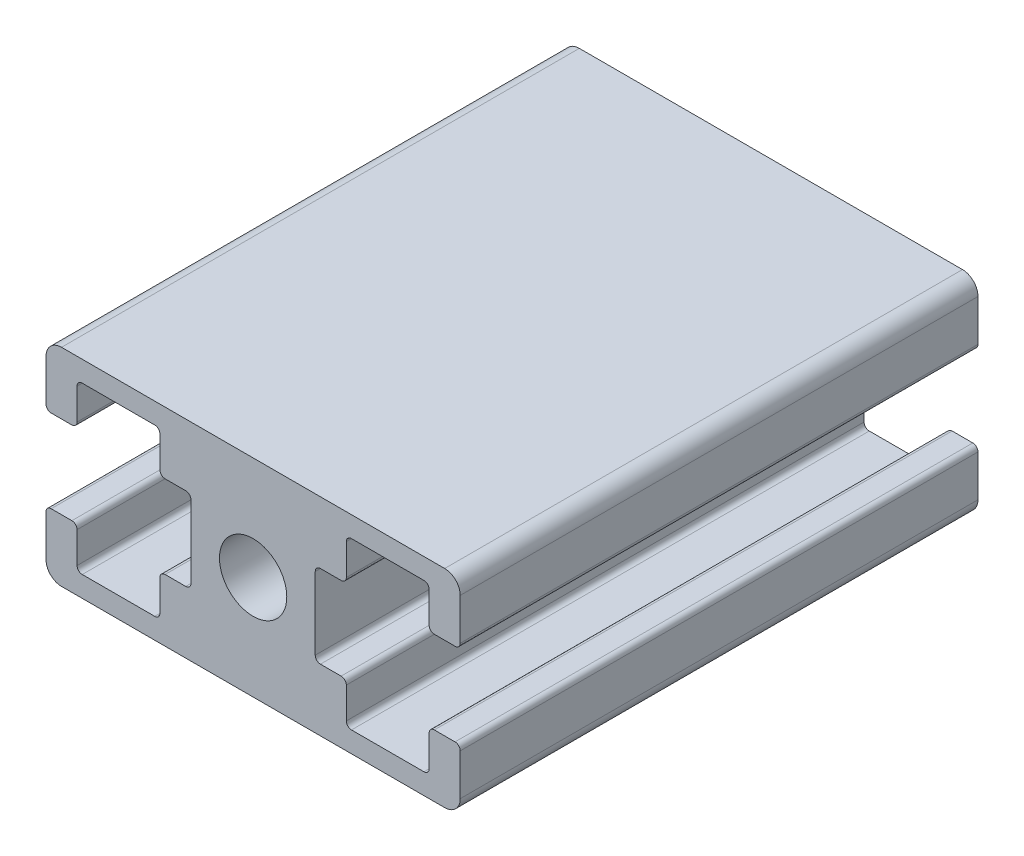
from build123d import *

# Parameters (mm, degrees)
SKETCH1_R           = 3.25
BOSS_EXTRUDE1_DEPTH = 50


with BuildPart() as part:
    # Sketch1 → Boss-Extrude1 (new body)
    with BuildSketch(Plane.XY):
        with BuildLine():
            Line((1.5, 0), (38.5, 0))
            ThreePointArc((38.5, 0), (39.560660172, 0.439339828), (40, 1.5))
            Line((40, 1.5), (40, 5.5))
            ThreePointArc((40, 5.5), (39.853553391, 5.853553391), (39.5, 6))
            Line((39.5, 6), (37.5, 6))
            ThreePointArc((37.5, 6), (37.146446609, 5.853553391), (37, 5.5))
            Line((37, 5.5), (37, 2.5))
            ThreePointArc((37, 2.5), (36.853553391, 2.146446609), (36.5, 2))
            Line((36.5, 2), (29.5, 2))
            ThreePointArc((29.5, 2), (29.146446609, 2.146446609), (29, 2.5))
            Line((29, 2.5), (29, 5.5))
            ThreePointArc((29, 5.5), (28.853553391, 5.853553391), (28.5, 6))
            Line((28.5, 6), (26.5, 6))
            ThreePointArc((26.5, 6), (26.146446609, 6.146446609), (26, 6.5))
            Line((26, 6.5), (26, 13.5))
            ThreePointArc((26, 13.5), (26.146446609, 13.853553391), (26.5, 14))
            Line((26.5, 14), (28.5, 14))
            ThreePointArc((28.5, 14), (28.853553391, 14.146446609), (29, 14.5))
            Line((29, 14.5), (29, 17.5))
            ThreePointArc((29, 17.5), (29.146446609, 17.853553391), (29.5, 18))
            Line((29.5, 18), (36.5, 18))
            ThreePointArc((36.5, 18), (36.853553391, 17.853553391), (37, 17.5))
            Line((37, 17.5), (37, 14.5))
            ThreePointArc((37, 14.5), (37.146446609, 14.146446609), (37.5, 14))
            Line((37.5, 14), (39.5, 14))
            ThreePointArc((39.5, 14), (39.853553391, 14.146446609), (40, 14.5))
            Line((40, 14.5), (40, 18.5))
            ThreePointArc((40, 18.5), (39.560660172, 19.560660172), (38.5, 20))
            Line((38.5, 20), (1.5, 20))
            ThreePointArc((1.5, 20), (0.439339828, 19.560660172), (0, 18.5))
            Line((0, 18.5), (0, 14.5))
            ThreePointArc((0, 14.5), (0.146446609, 14.146446609), (0.5, 14))
            Line((0.5, 14), (2.5, 14))
            ThreePointArc((2.5, 14), (2.853553391, 14.146446609), (3, 14.5))
            Line((3, 14.5), (3, 17.5))
            ThreePointArc((3, 17.5), (3.146446609, 17.853553391), (3.5, 18))
            Line((3.5, 18), (10.5, 18))
            ThreePointArc((10.5, 18), (10.853553391, 17.853553391), (11, 17.5))
            Line((11, 17.5), (11, 14.5))
            ThreePointArc((11, 14.5), (11.146446609, 14.146446609), (11.5, 14))
            Line((11.5, 14), (13.5, 14))
            ThreePointArc((13.5, 14), (13.853553391, 13.853553391), (14, 13.5))
            Line((14, 13.5), (14, 6.5))
            ThreePointArc((14, 6.5), (13.853553391, 6.146446609), (13.5, 6))
            Line((13.5, 6), (11.5, 6))
            ThreePointArc((11.5, 6), (11.146446609, 5.853553391), (11, 5.5))
            Line((11, 5.5), (11, 2.5))
            ThreePointArc((11, 2.5), (10.853553391, 2.146446609), (10.5, 2))
            Line((10.5, 2), (3.5, 2))
            ThreePointArc((3.5, 2), (3.146446609, 2.146446609), (3, 2.5))
            Line((3, 2.5), (3, 5.5))
            ThreePointArc((3, 5.5), (2.853553391, 5.853553391), (2.5, 6))
            Line((2.5, 6), (0.5, 6))
            ThreePointArc((0.5, 6), (0.146446609, 5.853553391), (0, 5.5))
            Line((0, 5.5), (0, 1.5))
            ThreePointArc((0, 1.5), (0.439339828, 0.439339828), (1.5, 0))
        make_face()
        with Locations((20, 10)):
            Circle(SKETCH1_R, mode=Mode.SUBTRACT)
    extrude(amount=BOSS_EXTRUDE1_DEPTH)


solid = part.part
